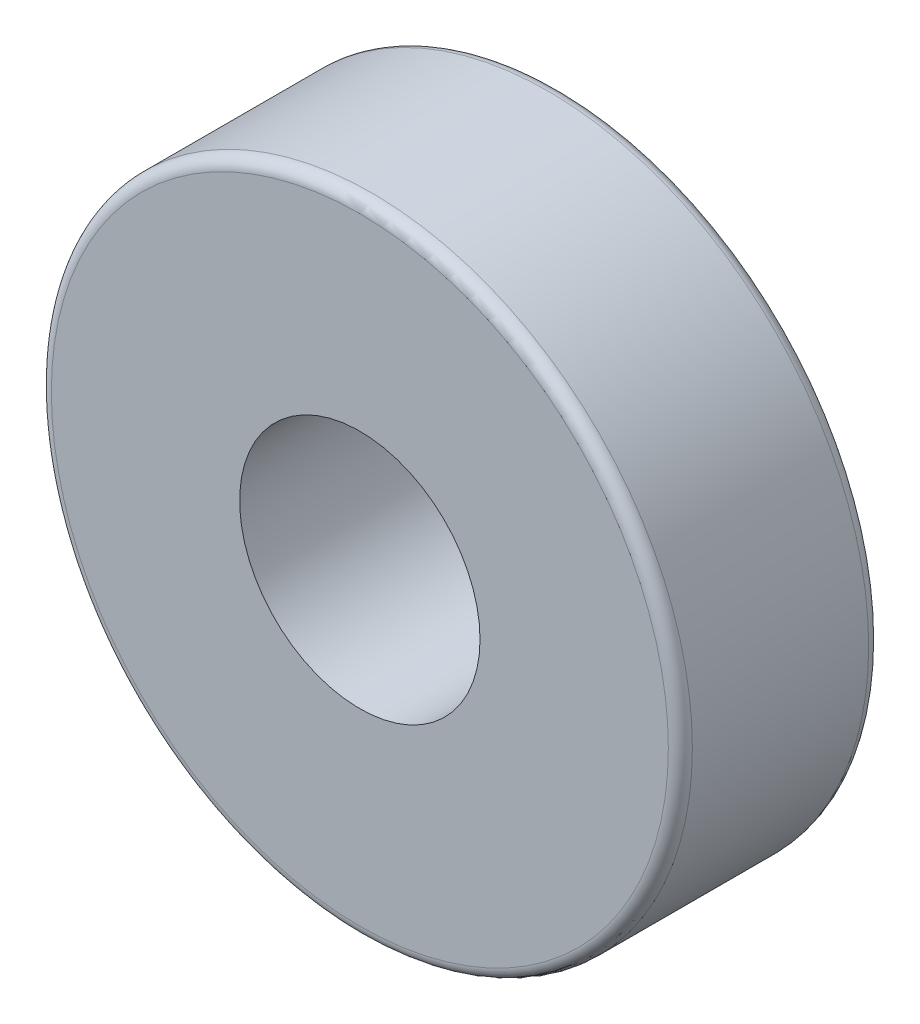
from build123d import *

# Parameters (mm, degrees)
SKETCH1_R           = 8
SKETCH1_R_2         = 3
BOSS_EXTRUDE1_DEPTH = 2.5
FILLET2_R           = 0.3


with BuildPart() as part:
    # Sketch1 → Boss-Extrude1 (new, symmetric)
    with BuildSketch(Plane.XY):
        Circle(SKETCH1_R)
        Circle(SKETCH1_R_2, mode=Mode.SUBTRACT)
    extrude(amount=BOSS_EXTRUDE1_DEPTH, both=True)

    # Fillet2
    fillet2_edges = [part.edges().sort_by_distance(p)[0] for p in [
        (-8, 0, -2.5),
        (-8, 0, 2.5),
        (-3, 0, -2.5),
    ]]
    fillet(fillet2_edges, radius=FILLET2_R)


solid = part.part
